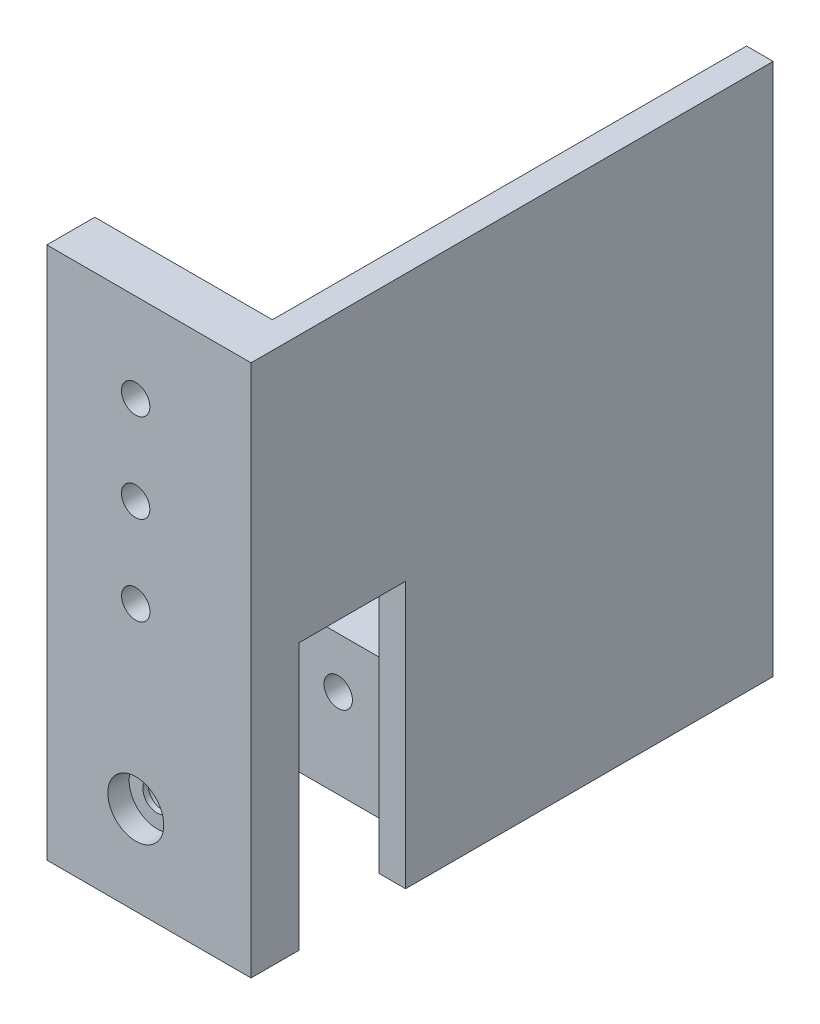
from build123d import *

# Parameters (mm, degrees)
SKETCH1_W            = 29.21
SKETCH1_H            = 76.2
BOSS_EXTRUDE1_DEPTH  = 6.858
SKETCH3_R            = 2.032
CUT_EXTRUDE1_DEPTH   = 25.4
SKETCH17_W           = 3.81
SKETCH17_H           = 76.2
BOSS_EXTRUDE13_DEPTH = 67.818
SKETCH18_W           = 3.81
SKETCH18_H           = 20.32
BOSS_EXTRUDE14_DEPTH = 25.4
SKETCH19_W           = 29.21
SKETCH19_H           = 19.948928224
BOSS_EXTRUDE15_DEPTH = 25.4
SKETCH4_R            = 2.032
CUT_EXTRUDE5_DEPTH   = 116.113658891
SKETCH21_R           = 4
SKETCH21_R_2         = 2
CUT_EXTRUDE6_DEPTH   = 3.048
CUT_EXTRUDE7_START   = -3.048
SKETCH22_R           = 4
CUT_EXTRUDE7_DEPTH   = 3.048
SKETCH23_W           = 15.24
SKETCH23_H           = 38.1
CUT_EXTRUDE8_DEPTH   = 109.488248995
SKETCH24_W           = 24.012467883
SKETCH24_H           = 25.448429418
CUT_EXTRUDE9_DEPTH   = 10.16


with BuildPart() as part:
    # Sketch1 → Boss-Extrude1 (new body)
    with BuildSketch(Plane.XY):
        with Locations((19.297661272, -42.679075546)):
            Rectangle(SKETCH1_W, SKETCH1_H)
    extrude(amount=BOSS_EXTRUDE1_DEPTH)

    # Sketch3 → Cut-Extrude1 (cut)
    with BuildSketch(Plane.XY.offset(6.858)):
        with Locations((17.413506863, -42.679058438)):
            Circle(SKETCH3_R)
        with Locations((17.392661272, -29.979075546)):
            Circle(SKETCH3_R)
        with Locations((17.392661272, -17.279075546)):
            Circle(SKETCH3_R)
    extrude(amount=-CUT_EXTRUDE1_DEPTH, mode=Mode.SUBTRACT)

    # Sketch17 → Boss-Extrude13 (add)
    with BuildSketch(Plane(origin=(0, 0, 0), x_dir=(-1, 0, 0), z_dir=(0, 0, -1))):
        with Locations((-31.997661272, -42.679075546)):
            Rectangle(SKETCH17_W, SKETCH17_H)
    extrude(amount=BOSS_EXTRUDE13_DEPTH)

    # Sketch18 → Boss-Extrude14 (add)
    with BuildSketch(Plane.ZY.offset(-30.092661272)):
        with Locations((-65.913, -70.619075546)):
            Rectangle(SKETCH18_W, SKETCH18_H)
    extrude(amount=BOSS_EXTRUDE14_DEPTH)

    # Sketch19 → Boss-Extrude15 (add)
    with BuildSketch(Plane.ZY.offset(-30.092661272)):
        with Locations((-36.703, -70.804611434)):
            Rectangle(SKETCH19_W, SKETCH19_H)
    extrude(amount=BOSS_EXTRUDE15_DEPTH)

    # Sketch4 → Cut-Extrude5 (cut, through all)
    with BuildSketch(Plane.XY.offset(6.858)):
        with Locations((17.413506863, -68.079058438)):
            Circle(SKETCH4_R)
    extrude(amount=-CUT_EXTRUDE5_DEPTH, mode=Mode.SUBTRACT)

    # Sketch21 → Cut-Extrude6 (cut)
    with BuildSketch(Plane(origin=(0, 0, 0), x_dir=(-1, 0, 0), z_dir=(0, 0, -1))):
        with Locations((-17.413506863, -68.079058438)):
            Circle(SKETCH21_R)
        with Locations((-17.413506863, -68.079058438)):
            Circle(SKETCH21_R_2, mode=Mode.SUBTRACT)
    extrude(amount=-CUT_EXTRUDE6_DEPTH, mode=Mode.SUBTRACT)

    # Sketch22 → Cut-Extrude7 (cut)
    with BuildSketch(Plane.XY.offset(6.858).offset(CUT_EXTRUDE7_START)):
        with Locations(Location((17.413506863, -68.079058438, 0), (0, 0, 180))):
            Circle(SKETCH22_R)
    extrude(amount=CUT_EXTRUDE7_DEPTH, mode=Mode.SUBTRACT)

    # Sketch23 → Cut-Extrude8 (cut, through all)
    with BuildSketch(Plane.ZY.offset(-30.092661272)):
        with Locations((-7.62, -61.729075546)):
            Rectangle(SKETCH23_W, SKETCH23_H)
    extrude(amount=-CUT_EXTRUDE8_DEPTH, mode=Mode.SUBTRACT)

    # Sketch24 → Cut-Extrude9 (cut)
    with BuildSketch(Plane.XZ.offset(80.779075546)):
        with Locations((18.088627796, -36.808482529)):
            Rectangle(SKETCH24_W, SKETCH24_H)
    extrude(amount=-CUT_EXTRUDE9_DEPTH, mode=Mode.SUBTRACT)


solid = part.part
